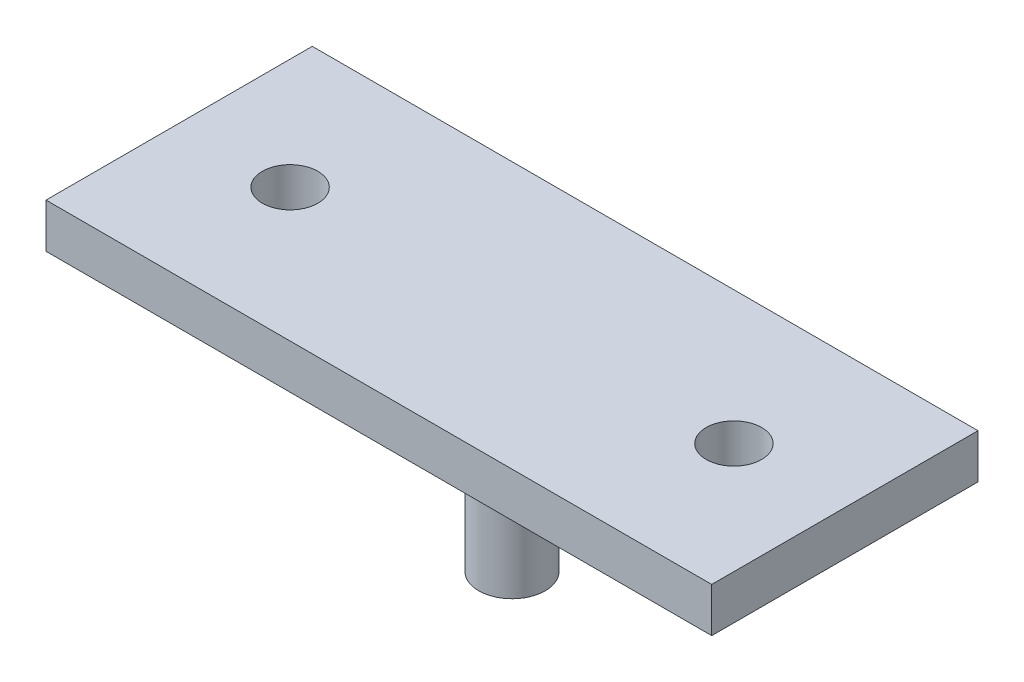
from build123d import *

# Parameters (mm, degrees)
SKETCH2_W           = 38.1
SKETCH2_H           = 15.24
SKETCH2_R           = 1.5875
BOSS_EXTRUDE1_DEPTH = 2.54
SKETCH3_R           = 1.905
BOSS_EXTRUDE2_DEPTH = 10.16


with BuildPart() as part:
    # Sketch2 → Boss-Extrude1 (new body)
    with BuildSketch(Plane(origin=(0, 0, 0), x_dir=(1, 0, 0), z_dir=(0, 1, 0))):
        Rectangle(SKETCH2_W, SKETCH2_H)
        with Locations(Location((12.7, 0, 0), (0, 0, 270))):
            Circle(SKETCH2_R, mode=Mode.SUBTRACT)
        with Locations(Location((-12.7, 0, 0), (0, 0, 90))):
            Circle(SKETCH2_R, mode=Mode.SUBTRACT)
    extrude(amount=BOSS_EXTRUDE1_DEPTH)

    # Sketch3 → Boss-Extrude2 (add)
    with BuildSketch(Plane.XZ):
        with Locations(Location((0, 0, 0), (0, 0, 270))):
            Circle(SKETCH3_R)
    extrude(amount=BOSS_EXTRUDE2_DEPTH)


solid = part.part
